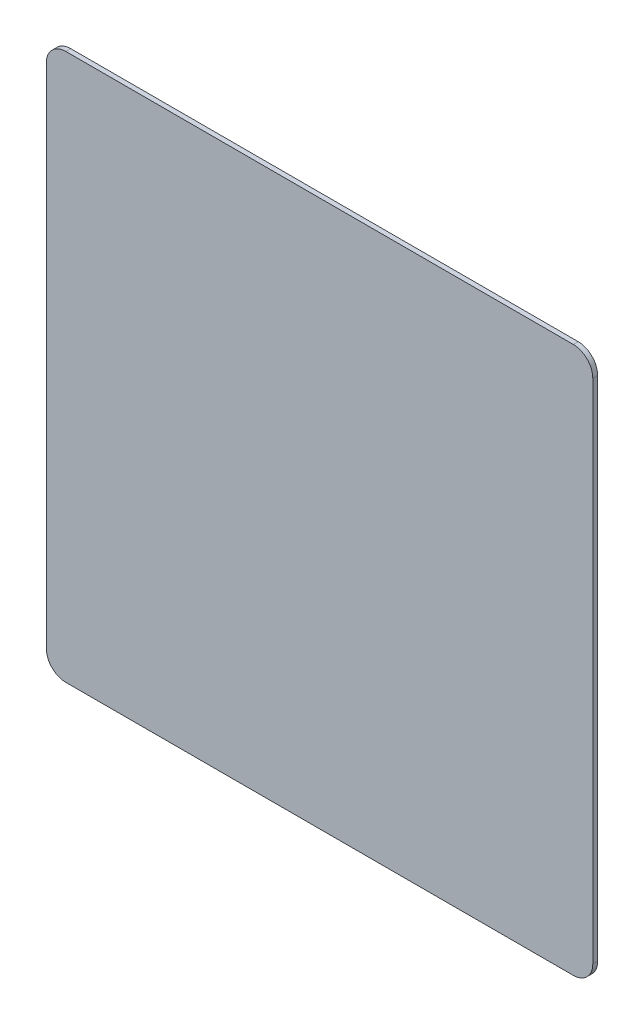
from build123d import *

# Parameters (mm, degrees)
ESQUISSE1_W             = 60
ESQUISSE1_H             = 60
BASE_EXTRUSION_DEPTH    = 7
ESQUISSE4_W             = 56
ESQUISSE4_H             = 56
BOSS_EXTRU_2_DEPTH      = 0.5
CONG_3_R                = 2
ESQUISSE5_W             = 60
ESQUISSE5_H             = 60
ENL_V_MAT_EXTRU_2_DEPTH = 7


with BuildPart() as part:
    # Esquisse1 → Base-Extrusion (new body)
    with BuildSketch(Plane.XY):
        Rectangle(ESQUISSE1_W, ESQUISSE1_H)
    extrude(amount=BASE_EXTRUSION_DEPTH)

    # Esquisse4 → Boss.-Extru.2 (add)
    with BuildSketch(Plane.XY.offset(7)):
        Rectangle(ESQUISSE4_W, ESQUISSE4_H)
    extrude(amount=BOSS_EXTRU_2_DEPTH)

    # Congé3
    cong_3_edges = [part.edges().sort_by_distance(p)[0] for p in [
        (-28, 28, 7.25),
        (28, 28, 7.25),
        (28, -28, 7.25),
        (-28, -28, 7.25),
    ]]
    fillet(cong_3_edges, radius=CONG_3_R)

    # Esquisse5 → Enlèv. mat.-Extru.2 (cut)
    with BuildSketch(Plane(origin=(0, 0, 0), x_dir=(-1, 0, 0), z_dir=(0, 0, -1))):
        Rectangle(ESQUISSE5_W, ESQUISSE5_H)
    extrude(amount=-ENL_V_MAT_EXTRU_2_DEPTH, mode=Mode.SUBTRACT)


solid = part.part
